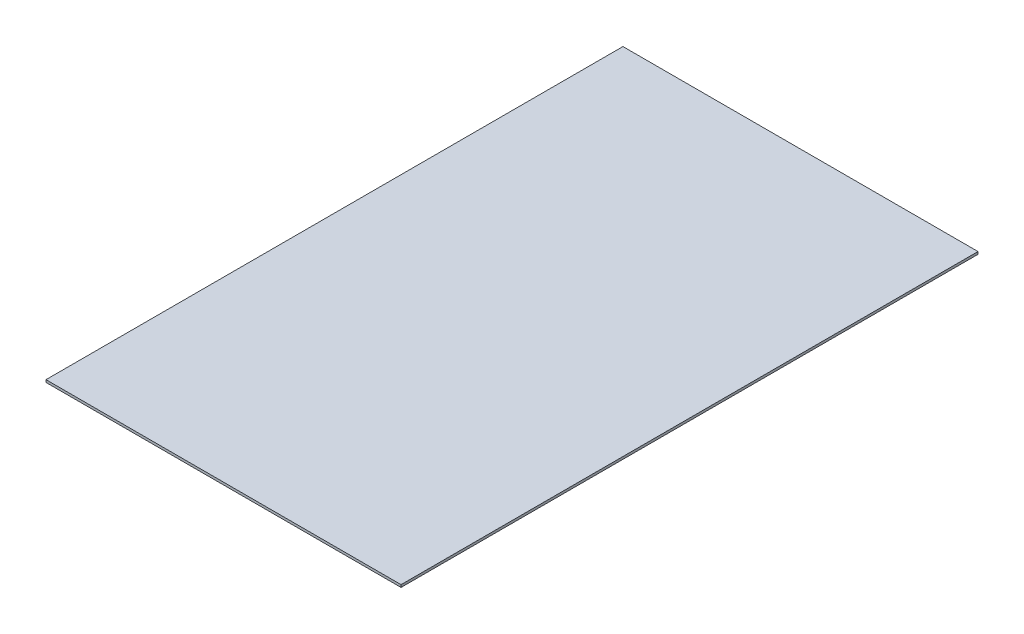
from build123d import *

# Parameters (mm, degrees)
SKETCH1_W           = 101.6
SKETCH1_H           = 165.1
BOSS_EXTRUDE1_DEPTH = 0.7


with BuildPart() as part:
    # Sketch1 → Boss-Extrude1 (new body)
    with BuildSketch(Plane(origin=(0, 0, 0), x_dir=(1, 0, 0), z_dir=(0, 1, 0))):
        with Locations((50.8, -82.55)):
            Rectangle(SKETCH1_W, SKETCH1_H)
    extrude(amount=BOSS_EXTRUDE1_DEPTH)


solid = part.part
